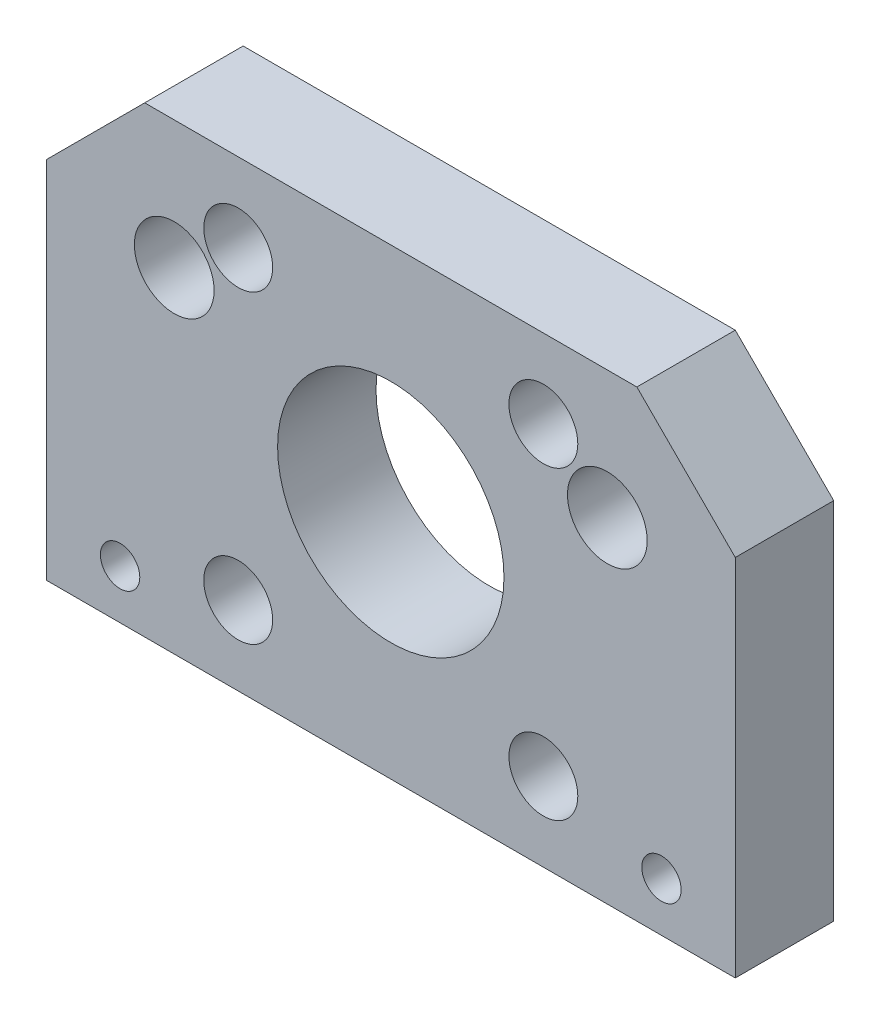
from build123d import *

# Parameters (mm, degrees)
SKETCH1_W           = 70
SKETCH1_H           = 47
BOSS_EXTRUDE1_DEPTH = 10
SKETCH2_R           = 11.5
CUT_EXTRUDE1_DEPTH  = 10
SKETCH3_R           = 1.5
CUT_EXTRUDE2_DEPTH  = 10
SKETCH4_R           = 4.05
CUT_EXTRUDE3_DEPTH  = 10
SKETCH6_R           = 2
CUT_EXTRUDE5_DEPTH  = 10
SKETCH7_R           = 3.5
CUT_EXTRUDE6_DEPTH  = 7
CHAMFER1_SIZE       = 10


with BuildPart() as part:
    # Sketch1 → Boss-Extrude1 (new body)
    with BuildSketch(Plane.XY):
        Rectangle(SKETCH1_W, SKETCH1_H)
    extrude(amount=BOSS_EXTRUDE1_DEPTH)

    # Sketch2 → Cut-Extrude1 (cut)
    with BuildSketch(Plane.XY.offset(10)):
        Circle(SKETCH2_R)
    extrude(amount=-CUT_EXTRUDE1_DEPTH, mode=Mode.SUBTRACT)

    # Sketch3 → Cut-Extrude2 (cut)
    with BuildSketch(Plane.XY.offset(10)):
        with Locations((-15.5, 15.5)):
            Circle(SKETCH3_R)
        with Locations((15.5, 15.5)):
            Circle(SKETCH3_R)
        with Locations((15.5, -15.5)):
            Circle(SKETCH3_R)
        with Locations((-15.5, -15.5)):
            Circle(SKETCH3_R)
    extrude(amount=-CUT_EXTRUDE2_DEPTH, mode=Mode.SUBTRACT)

    # Sketch4 → Cut-Extrude3 (cut)
    with BuildSketch(Plane.XY.offset(10)):
        with Locations((-22, 10.5)):
            Circle(SKETCH4_R)
        with Locations((22, 10.5)):
            Circle(SKETCH4_R)
    extrude(amount=-CUT_EXTRUDE3_DEPTH, mode=Mode.SUBTRACT)

    # Sketch6 → Cut-Extrude5 (cut)
    with BuildSketch(Plane.XY.offset(10)):
        with Locations((-27.5, -18.5)):
            Circle(SKETCH6_R)
        with Locations((27.5, -18.5)):
            Circle(SKETCH6_R)
    extrude(amount=-CUT_EXTRUDE5_DEPTH, mode=Mode.SUBTRACT)

    # Sketch7 → Cut-Extrude6 (cut)
    with BuildSketch(Plane.XY.offset(10)):
        with Locations((-15.5, -15.5)):
            Circle(SKETCH7_R)
        with Locations((-15.5, 15.5)):
            Circle(SKETCH7_R)
        with Locations((15.5, 15.5)):
            Circle(SKETCH7_R)
        with Locations((15.5, -15.5)):
            Circle(SKETCH7_R)
    extrude(amount=-CUT_EXTRUDE6_DEPTH, mode=Mode.SUBTRACT)

    # Chamfer1
    chamfer1_edges = [part.edges().sort_by_distance(p)[0] for p in [
        (-35, 23.5, 5),
        (35, 23.5, 5),
    ]]
    chamfer(chamfer1_edges, length=CHAMFER1_SIZE)


solid = part.part
